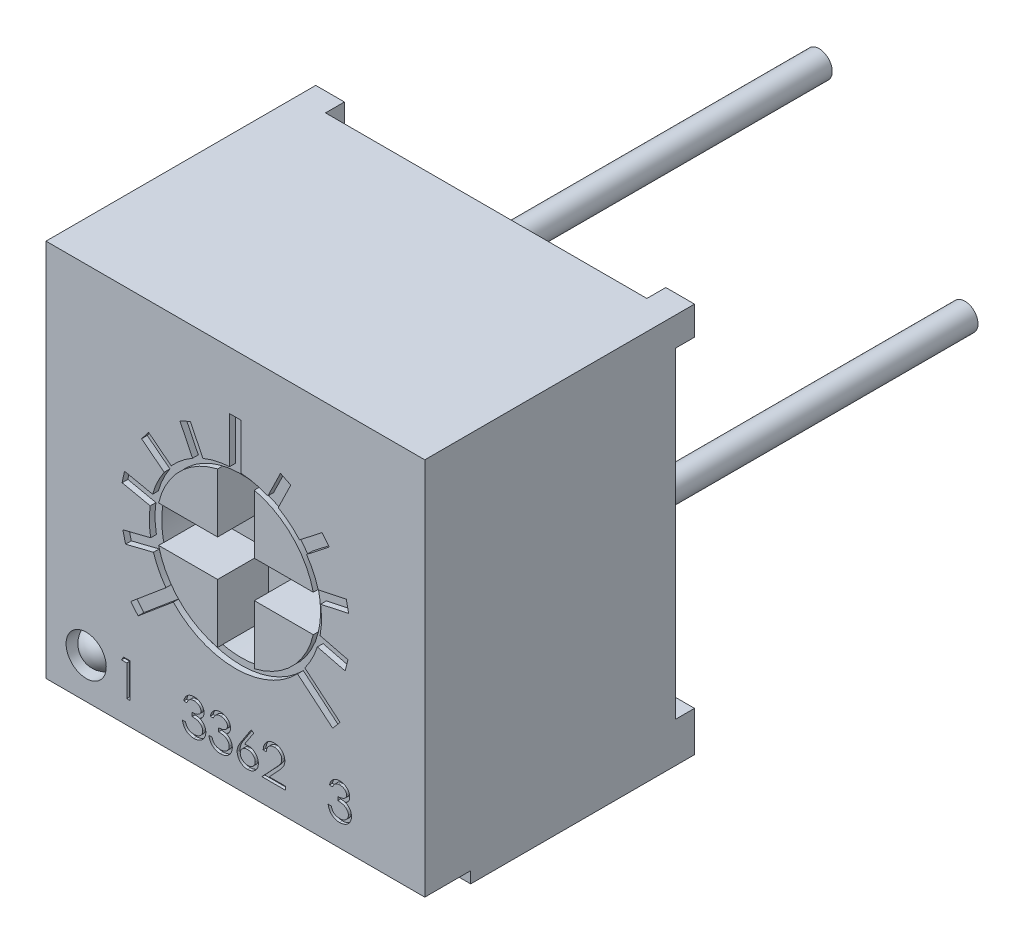
from build123d import *

# Parameters (mm, degrees)
SKETCH_1_W          = 6.6
SKETCH_1_H          = 6.6
EXTRUDE_1_DEPTH     = 4.7
SKETCH_2_R          = 1.385
CUT_EXTRUDE_1_DEPTH = 0.9
EXTRUDE_2_DEPTH     = 0.89
EXTRUDE_2_2_DEPTH   = 0.89
EXTRUDE_2_3_DEPTH   = 0.89
EXTRUDE_2_4_DEPTH   = 0.89
SKETCH_4_R          = 1.385
CUT_EXTRUDE_2_DEPTH = 0.1
SKETCH_6_R          = 0.35
CUT_EXTRUDE_3_DEPTH = 0.35
DOME_1_FACE_RADIUS  = 0.35
DOME_1_HEIGHT       = 0.35
SKETCH_13_W         = 0.53
SKETCH_13_H         = 3.9
SKETCH_13_W_2       = 2.08
EXTRUDE_4_DEPTH     = 0.2
SKETCH_14_W         = 1.04
SKETCH_14_H         = 3.9
EXTRUDE_5_DEPTH     = 0.254
SKETCH_8_W          = 5.6
SKETCH_8_H          = 0.33
CUT_EXTRUDE_4_DEPTH = 10.096093447
SKETCH_9_W          = 0.33
SKETCH_9_H          = 5.6
CUT_EXTRUDE_5_DEPTH = 9.929866516
SKETCH_10_R         = 0.23
EXTRUDE_3_DEPTH     = 5.8
EXTRUDE_3_2_DEPTH   = 5.8
EXTRUDE_3_3_DEPTH   = 5.8
CUT_EXTRUDE_6_DEPTH = 0.05


with BuildPart() as part:
    # Эскиз1 → Бобышка-Вытянуть1 (new body)
    with BuildSketch(Plane.XY):
        Rectangle(SKETCH_1_W, SKETCH_1_H)
    extrude(amount=EXTRUDE_1_DEPTH)

    # Эскиз2 → Вырез-Вытянуть1 (cut)
    with BuildSketch(Plane.XY.offset(4.7)):
        Circle(SKETCH_2_R)
    extrude(amount=-CUT_EXTRUDE_1_DEPTH, mode=Mode.SUBTRACT)

    # Эскиз4 → Вырез-Вытянуть2 (cut)
    with BuildSketch(Plane.XY.offset(4.7)):
        with BuildLine():
            Line((-0.1, 2.296662955), (-0.1, 1.496662955))
            ThreePointArc((-0.1, 1.496662955), (-0.337426582, 1.461555097), (-0.566214451, 1.389028868))
            Line((-0.566214451, 1.389028868), (-0.785400025, 1.838425891))
            Line((-0.785400025, 1.838425891), (-0.965158834, 1.750751661))
            Line((-0.965158834, 1.750751661), (-0.74597326, 1.301354638))
            ThreePointArc((-0.74597326, 1.301354638), (-0.943980587, 1.165718942), (-1.117820355, 1.000238798))
            Line((-1.117820355, 1.000238798), (-1.511825732, 1.308069536))
            Line((-1.511825732, 1.308069536), (-1.634958027, 1.150467385))
            Line((-1.634958027, 1.150467385), (-1.24095265, 0.842636647))
            ThreePointArc((-1.24095265, 0.842636647), (-1.359461681, 0.633927393), (-1.443166109, 0.408988486))
            Line((-1.443166109, 0.408988486), (-1.93223991, 0.512944331))
            Line((-1.93223991, 0.512944331), (-1.973822248, 0.317314811))
            Line((-1.973822248, 0.317314811), (-1.484748447, 0.213358965))
            ThreePointArc((-1.484748447, 0.213358965), (-1.499771543, -0.02617861), (-1.476397858, -0.265045966))
            Line((-1.476397858, -0.265045966), (-1.961545721, -0.386006914))
            Line((-1.961545721, -0.386006914), (-1.913161342, -0.58006606))
            Line((-1.913161342, -0.58006606), (-1.428013479, -0.459105112))
            ThreePointArc((-1.428013479, -0.459105112), (-1.336509786, -0.68098575), (-1.210789101, -0.885431959))
            Line((-1.210789101, -0.885431959), (-1.823624655, -1.399662047))
            Line((-1.823624655, -1.399662047), (-1.695067133, -1.552870935))
            Line((-1.695067133, -1.552870935), (-1.082231579, -1.038640847))
            ThreePointArc((-1.082231579, -1.038640847), (0, -1.5), (1.082231579, -1.038640847))
            Line((1.082231579, -1.038640847), (1.695067133, -1.552870935))
            Line((1.695067133, -1.552870935), (1.823624655, -1.399662047))
            Line((1.823624655, -1.399662047), (1.210789101, -0.885431959))
            ThreePointArc((1.210789101, -0.885431959), (1.336509786, -0.68098575), (1.428013479, -0.459105112))
            Line((1.428013479, -0.459105112), (1.913161342, -0.58006606))
            Line((1.913161342, -0.58006606), (1.961545721, -0.386006914))
            Line((1.961545721, -0.386006914), (1.476397858, -0.265045966))
            ThreePointArc((1.476397858, -0.265045966), (1.499771543, -0.02617861), (1.484748447, 0.213358965))
            Line((1.484748447, 0.213358965), (1.973822248, 0.317314811))
            Line((1.973822248, 0.317314811), (1.93223991, 0.512944331))
            Line((1.93223991, 0.512944331), (1.443166109, 0.408988486))
            ThreePointArc((1.443166109, 0.408988486), (1.359461681, 0.633927393), (1.24095265, 0.842636647))
            Line((1.24095265, 0.842636647), (1.634958027, 1.150467385))
            Line((1.634958027, 1.150467385), (1.511825732, 1.308069536))
            Line((1.511825732, 1.308069536), (1.117820355, 1.000238798))
            ThreePointArc((1.117820355, 1.000238798), (0.943980587, 1.165718942), (0.74597326, 1.301354638))
            Line((0.74597326, 1.301354638), (0.965158834, 1.750751661))
            Line((0.965158834, 1.750751661), (0.785400025, 1.838425891))
            Line((0.785400025, 1.838425891), (0.566214451, 1.389028868))
            ThreePointArc((0.566214451, 1.389028868), (0.337426582, 1.461555097), (0.1, 1.496662955))
            Line((0.1, 1.496662955), (0.1, 2.296662955))
            Line((0.1, 2.296662955), (-0.1, 2.296662955))
        make_face()
        Circle(SKETCH_4_R, mode=Mode.SUBTRACT)
    extrude(amount=-CUT_EXTRUDE_2_DEPTH, mode=Mode.SUBTRACT)

    # Эскиз6 → Вырез-Вытянуть3 (cut)
    with BuildSketch(Plane.XY.offset(4.7)):
        with Locations((-2.6, -2.6)):
            Circle(SKETCH_6_R)
    extrude(amount=-CUT_EXTRUDE_3_DEPTH, mode=Mode.SUBTRACT)

    # Купол1: a dome of height H over a round flat face of radius A is a cap of a sphere of radius (A * A + H * H) / (2 * H)
    dome_1_r = (DOME_1_FACE_RADIUS * DOME_1_FACE_RADIUS + DOME_1_HEIGHT * DOME_1_HEIGHT) / (2 * DOME_1_HEIGHT)
    dome_1_base = Plane((-2.6, -2.6, 4.35), z_dir=(0, 0, 1))
    with Locations(dome_1_base.offset(DOME_1_HEIGHT - dome_1_r)):
        dome_1_ball = Sphere(dome_1_r, mode=Mode.PRIVATE)
    add(split(dome_1_ball, bisect_by=dome_1_base, keep=Keep.TOP, mode=Mode.PRIVATE))

    # Эскиз13 → Бобышка-Вытянуть4 (add)
    with BuildSketch(Plane.XZ.offset(3.3)):
        with Locations((-3.035, 1.95)):
            Rectangle(SKETCH_13_W, SKETCH_13_H)
        with Locations((-1.27, 1.95)):
            Rectangle(SKETCH_13_W_2, SKETCH_13_H)
        with Locations((1.27, 1.95)):
            Rectangle(SKETCH_13_W_2, SKETCH_13_H)
        with Locations((3.035, 1.95)):
            Rectangle(SKETCH_13_W, SKETCH_13_H)
    extrude(amount=EXTRUDE_4_DEPTH)

    # Эскиз14 → Бобышка-Вытянуть5 (add)
    with BuildSketch(Plane(origin=(0, -3.5, 0), x_dir=(-1, 0, 0), z_dir=(0, -1, 0))):
        with Locations((1.79, -1.95)):
            Rectangle(SKETCH_14_W, SKETCH_14_H)
        with Locations((-1.79, -1.95)):
            Rectangle(SKETCH_14_W, SKETCH_14_H)
    extrude(amount=EXTRUDE_5_DEPTH)

    # Эскиз8 → Вырез-Вытянуть4 (cut, through all)
    with BuildSketch(Plane(origin=(0, 3.3, 0), x_dir=(1, 0, 0), z_dir=(0, 1, 0))):
        with Locations((0, -0.165)):
            Rectangle(SKETCH_8_W, SKETCH_8_H)
    extrude(amount=-CUT_EXTRUDE_4_DEPTH, mode=Mode.SUBTRACT)

    # Эскиз9 → Вырез-Вытянуть5 (cut, through all)
    with BuildSketch(Plane(origin=(3.3, 0, 0), x_dir=(0, 0, -1), z_dir=(1, 0, 0))):
        with Locations((-0.165, 0)):
            Rectangle(SKETCH_9_W, SKETCH_9_H)
    extrude(amount=-CUT_EXTRUDE_5_DEPTH, mode=Mode.SUBTRACT)

    # Эскиз11 → Вырез-Вытянуть6 (cut)
    # profile 1 of 6: a face of its own
    with BuildSketch(Plane.XY.offset(4.7)):
        Polygon((-1.949399038, -2.3), (-1.838461538, -2.3), (-1.838461538, -2.9), (-1.892307692, -2.9), (-1.892307692, -2.361538462), (-1.984615385, -2.361538462), align=None)
    # profile 2 of 6: a face of its own
    with BuildSketch(Plane.XY.offset(4.7)):
        with BuildLine():
            Line((-0.846153846, -2.438461538), (-0.9, -2.438461538))
            add(Edge.make_bspline(
                [(-0.9, -2.438461538), (-0.89854122, -2.432421684), (-0.895689424, -2.420614263), (-0.889741269, -2.403744447), (-0.883261396, -2.387780414), (-0.875480407, -2.373021087), (-0.866993192, -2.359169847), (-0.857269297, -2.346540854), (-0.846757344, -2.334812917), (-0.83513021, -2.324404934), (-0.822936725, -2.31498018), (-0.810005076, -2.306944456), (-0.796595437, -2.300031744), (-0.7826149, -2.294336847), (-0.768021842, -2.290046757), (-0.752948193, -2.286934162), (-0.73735445, -2.284912828), (-0.726769148, -2.284715555), (-0.721394231, -2.284615385)],
                knots=[0, 0, 0, 0, 1.162005537, 2.271625781, 3.343758855, 4.383309926, 5.390229558, 6.379919256, 7.361854164, 8.333198761, 9.295911338, 10.242430842, 11.177959212, 12.116337295, 13.062827104, 14.020064771, 14.994644689, 16, 16, 16, 16], degree=3))
            add(Edge.make_bspline(
                [(-0.721394231, -2.284615385), (-0.713562904, -2.284851824), (-0.698071073, -2.285319546), (-0.675311694, -2.289590592), (-0.653364239, -2.296349186), (-0.632468939, -2.305687539), (-0.613060065, -2.317205364), (-0.595791005, -2.330913605), (-0.580895831, -2.346547771), (-0.568399652, -2.36381621), (-0.558615367, -2.382271441), (-0.55140056, -2.401265753), (-0.547008272, -2.420754091), (-0.546439033, -2.433912482), (-0.546153846, -2.440504808)],
                knots=[0, 0, 0, 0, 1.083050992, 2.142477498, 3.193116406, 4.255571735, 5.30263384, 6.308962982, 7.297363603, 8.282367274, 9.249857812, 10.179914175, 11.08814088, 12, 12, 12, 12], degree=3))
            add(Edge.make_bspline(
                [(-0.546153846, -2.440504808), (-0.546353319, -2.44684883), (-0.546743656, -2.459263096), (-0.550058006, -2.477386781), (-0.555635651, -2.494468199), (-0.563361896, -2.510579255), (-0.573363304, -2.525617799), (-0.585478624, -2.539617666), (-0.599793366, -2.55264095), (-0.610641184, -2.560101431), (-0.616225962, -2.563942308)],
                knots=[0, 0, 0, 0, 1.024540389, 2.004866551, 2.965041327, 3.920577974, 4.882998113, 5.874504559, 6.905732034, 8, 8, 8, 8], degree=3))
            add(Edge.make_bspline(
                [(-0.616225962, -2.563942308), (-0.609843375, -2.56702428), (-0.597197625, -2.573130558), (-0.579960392, -2.585105831), (-0.564312756, -2.598932634), (-0.555586404, -2.609722803), (-0.551201923, -2.615144231)],
                knots=[0, 0, 0, 0, 1.015518401, 2.012035669, 3.001164323, 4, 4, 4, 4], degree=3))
            add(Edge.make_bspline(
                [(-0.551201923, -2.615144231), (-0.548314836, -2.619096988), (-0.542587939, -2.626937774), (-0.535518991, -2.639544018), (-0.529106, -2.652289988), (-0.524108819, -2.665517315), (-0.520239013, -2.679072688), (-0.517472837, -2.692979385), (-0.515754412, -2.70724876), (-0.515508318, -2.716902328), (-0.515384615, -2.721754808)],
                knots=[0, 0, 0, 0, 1.025084078, 2.033381695, 3.024893161, 4.013698104, 4.991890475, 5.976764909, 6.982997093, 8, 8, 8, 8], degree=3))
            add(Edge.make_bspline(
                [(-0.515384615, -2.721754808), (-0.515692246, -2.730156474), (-0.51630606, -2.746920269), (-0.521792473, -2.771687364), (-0.5302976, -2.79589745), (-0.542375932, -2.819053137), (-0.557096076, -2.840718345), (-0.57460876, -2.860102855), (-0.594715002, -2.876765473), (-0.617138827, -2.890687226), (-0.641433192, -2.901816013), (-0.667417579, -2.909540146), (-0.694717589, -2.914570889), (-0.71343884, -2.915110352), (-0.722956731, -2.915384615)],
                knots=[0, 0, 0, 0, 0.955779014, 1.907060117, 2.875433937, 3.871313158, 4.872415639, 5.851225146, 6.836215519, 7.83643374, 8.849228613, 9.86973379, 10.916971861, 12, 12, 12, 12], degree=3))
            add(Edge.make_bspline(
                [(-0.722956731, -2.915384615), (-0.729371468, -2.915235779), (-0.741993532, -2.914942918), (-0.76054956, -2.912940872), (-0.778261851, -2.9092843), (-0.795154354, -2.904363733), (-0.811242074, -2.898125149), (-0.826475921, -2.890356229), (-0.840949617, -2.881217115), (-0.85452658, -2.870599928), (-0.867205192, -2.858723127), (-0.878648516, -2.845375868), (-0.889047337, -2.830804885), (-0.898123218, -2.814840932), (-0.906289553, -2.797690317), (-0.913006288, -2.779133431), (-0.9189181, -2.75933617), (-0.921666694, -2.745539986), (-0.923076923, -2.738461538)],
                knots=[0, 0, 0, 0, 1.048658725, 2.063410685, 3.046034179, 4.001477787, 4.936774919, 5.862367409, 6.792675028, 7.730719943, 8.675894397, 9.627829632, 10.600096036, 11.597688215, 12.626045268, 13.701542398, 14.82072376, 16, 16, 16, 16], degree=3))
            Line((-0.923076923, -2.738461538), (-0.869230769, -2.738461538))
            add(Edge.make_bspline(
                [(-0.869230769, -2.738461538), (-0.867827919, -2.743081369), (-0.865099254, -2.752067342), (-0.860454517, -2.764999965), (-0.855162814, -2.776855632), (-0.849486032, -2.78772131), (-0.843524013, -2.797704007), (-0.836852883, -2.806539756), (-0.829966744, -2.814616648), (-0.824775997, -2.819167153), (-0.822235577, -2.821394231)],
                knots=[0, 0, 0, 0, 1.198163088, 2.33053128, 3.407730985, 4.417276592, 5.372219308, 6.28897303, 7.162600585, 8, 8, 8, 8], degree=3))
            add(Edge.make_bspline(
                [(-0.822235577, -2.821394231), (-0.818876164, -2.823984231), (-0.812167707, -2.829156236), (-0.801236011, -2.835756515), (-0.789739173, -2.841475548), (-0.777428086, -2.845844182), (-0.764568411, -2.84954321), (-0.750952291, -2.85196387), (-0.736699854, -2.853624699), (-0.726968237, -2.853771259), (-0.721995192, -2.853846154)],
                knots=[0, 0, 0, 0, 0.946170439, 1.889420265, 2.845303464, 3.807233317, 4.801018734, 5.828864929, 6.890507805, 8, 8, 8, 8], degree=3))
            add(Edge.make_bspline(
                [(-0.721995192, -2.853846154), (-0.716380306, -2.85374057), (-0.705400881, -2.85353411), (-0.689380048, -2.851635418), (-0.674138771, -2.848870204), (-0.65984627, -2.844599407), (-0.646315326, -2.839322689), (-0.633735614, -2.832697248), (-0.621941996, -2.824923868), (-0.611085526, -2.816088583), (-0.601323439, -2.806416327), (-0.592728094, -2.7962998), (-0.585421009, -2.785781658), (-0.579526682, -2.774803695), (-0.574872302, -2.76341137), (-0.571703753, -2.751572713), (-0.569500636, -2.739384611), (-0.569321217, -2.731099644), (-0.569230769, -2.726923077)],
                knots=[0, 0, 0, 0, 1.217147791, 2.380027433, 3.494444702, 4.572153297, 5.609568379, 6.639424714, 7.649109417, 8.668170816, 9.669597737, 10.625200337, 11.543417969, 12.441394052, 13.322311151, 14.205496177, 15.095365482, 16, 16, 16, 16], degree=3))
            add(Edge.make_bspline(
                [(-0.569230769, -2.726923077), (-0.569493107, -2.721332562), (-0.570016476, -2.710179349), (-0.574012233, -2.693770622), (-0.580584609, -2.677960894), (-0.589785611, -2.663019901), (-0.600986022, -2.649172604), (-0.614077149, -2.636817493), (-0.629167702, -2.62662262), (-0.643056823, -2.61957885), (-0.655359421, -2.614772495), (-0.665887772, -2.611571072), (-0.677674619, -2.60886016), (-0.690577421, -2.606338056), (-0.704693401, -2.604191539), (-0.720007191, -2.602401514), (-0.736521893, -2.600969221), (-0.747954664, -2.600329605), (-0.753846154, -2.6)],
                knots=[0, 0, 0, 0, 1.07054697, 2.135767047, 3.216561865, 4.33974944, 5.486079747, 6.621378074, 7.775625952, 8.963672916, 9.598146892, 10.304877434, 11.070270905, 11.915000392, 12.823868403, 13.805723172, 14.86925407, 16, 16, 16, 16], degree=3))
            Line((-0.753846154, -2.6), (-0.753846154, -2.538461538))
            add(Edge.make_bspline(
                [(-0.753846154, -2.538461538), (-0.746423097, -2.538335572), (-0.731883152, -2.538088835), (-0.710644128, -2.535104605), (-0.690334417, -2.530976497), (-0.671404119, -2.524653321), (-0.654150054, -2.51730927), (-0.639180979, -2.508763177), (-0.626706611, -2.499263506), (-0.61678757, -2.48866363), (-0.609325417, -2.477295336), (-0.603869394, -2.465446766), (-0.600646481, -2.45301407), (-0.600216252, -2.44452927), (-0.6, -2.440264423)],
                knots=[0, 0, 0, 0, 1.321986639, 2.589447074, 3.816329219, 5.01088745, 6.139805852, 7.153945165, 8.075214402, 8.924034688, 9.728124013, 10.488707548, 11.240355623, 12, 12, 12, 12], degree=3))
            add(Edge.make_bspline(
                [(-0.6, -2.440264423), (-0.600071042, -2.437131095), (-0.600212376, -2.430897488), (-0.601994767, -2.421790334), (-0.604673174, -2.4129616), (-0.608355413, -2.404448833), (-0.613284019, -2.396311071), (-0.619182188, -2.388478937), (-0.626205291, -2.380997147), (-0.634253082, -2.374023378), (-0.642895105, -2.367377223), (-0.652366495, -2.361734885), (-0.662381674, -2.356910017), (-0.672951729, -2.352931245), (-0.684110963, -2.349938224), (-0.695806944, -2.347789223), (-0.708061975, -2.346445625), (-0.716422844, -2.346252182), (-0.720673077, -2.346153846)],
                knots=[0, 0, 0, 0, 0.884392785, 1.759457502, 2.611959086, 3.489218968, 4.37281399, 5.2945488, 6.255912374, 7.266815255, 8.301784654, 9.332968512, 10.37626691, 11.440494194, 12.520033166, 13.637162961, 14.798855837, 16, 16, 16, 16], degree=3))
            add(Edge.make_bspline(
                [(-0.720673077, -2.346153846), (-0.727504791, -2.346392365), (-0.740848719, -2.346858249), (-0.760085562, -2.350938765), (-0.777968876, -2.357449294), (-0.791638362, -2.365220669), (-0.801732517, -2.372892172), (-0.808945707, -2.379592009), (-0.816029223, -2.387037636), (-0.822517053, -2.395687643), (-0.829078306, -2.404956236), (-0.83505166, -2.415314582), (-0.840856178, -2.426492478), (-0.844353758, -2.434394586), (-0.846153846, -2.438461538)],
                knots=[0, 0, 0, 0, 1.472543308, 2.876219568, 4.221790263, 5.565193594, 6.249813518, 6.953379497, 7.687249741, 8.463570142, 9.283606569, 10.136032583, 11.040678096, 12, 12, 12, 12], degree=3))
        make_face()
    # profile 3 of 6: a face of its own
    with BuildSketch(Plane.XY.offset(4.7)):
        with BuildLine():
            Line((-0.384615385, -2.438461538), (-0.438461538, -2.438461538))
            add(Edge.make_bspline(
                [(-0.438461538, -2.438461538), (-0.437002758, -2.432421684), (-0.434150963, -2.420614263), (-0.428202807, -2.403744447), (-0.421722935, -2.387780414), (-0.413941945, -2.373021087), (-0.40545473, -2.359169847), (-0.395730835, -2.346540854), (-0.385218883, -2.334812917), (-0.373591749, -2.324404934), (-0.361398264, -2.31498018), (-0.348466615, -2.306944456), (-0.335056976, -2.300031744), (-0.321076439, -2.294336847), (-0.306483381, -2.290046757), (-0.291409731, -2.286934162), (-0.275815988, -2.284912828), (-0.265230687, -2.284715555), (-0.259855769, -2.284615385)],
                knots=[0, 0, 0, 0, 1.162005537, 2.271625781, 3.343758855, 4.383309926, 5.390229558, 6.379919256, 7.361854164, 8.333198761, 9.295911338, 10.242430842, 11.177959212, 12.116337295, 13.062827104, 14.020064771, 14.994644689, 16, 16, 16, 16], degree=3))
            add(Edge.make_bspline(
                [(-0.259855769, -2.284615385), (-0.252024442, -2.284851824), (-0.236532612, -2.285319546), (-0.213773232, -2.289590592), (-0.191825777, -2.296349186), (-0.170930478, -2.305687539), (-0.151521604, -2.317205364), (-0.134252543, -2.330913605), (-0.11935737, -2.346547771), (-0.106861191, -2.36381621), (-0.097076905, -2.382271441), (-0.089862098, -2.401265753), (-0.08546981, -2.420754091), (-0.084900572, -2.433912482), (-0.084615385, -2.440504808)],
                knots=[0, 0, 0, 0, 1.083050992, 2.142477498, 3.193116406, 4.255571735, 5.30263384, 6.308962982, 7.297363603, 8.282367274, 9.249857812, 10.179914175, 11.08814088, 12, 12, 12, 12], degree=3))
            add(Edge.make_bspline(
                [(-0.084615385, -2.440504808), (-0.084814857, -2.44684883), (-0.085205195, -2.459263096), (-0.088519544, -2.477386781), (-0.094097189, -2.494468199), (-0.101823434, -2.510579255), (-0.111824843, -2.525617799), (-0.123940162, -2.539617666), (-0.138254904, -2.55264095), (-0.149102722, -2.560101431), (-0.1546875, -2.563942308)],
                knots=[0, 0, 0, 0, 1.024540389, 2.004866551, 2.965041327, 3.920577974, 4.882998113, 5.874504559, 6.905732034, 8, 8, 8, 8], degree=3))
            add(Edge.make_bspline(
                [(-0.1546875, -2.563942308), (-0.148304914, -2.56702428), (-0.135659164, -2.573130558), (-0.11842193, -2.585105831), (-0.102774294, -2.598932634), (-0.094047942, -2.609722803), (-0.089663462, -2.615144231)],
                knots=[0, 0, 0, 0, 1.015518401, 2.012035669, 3.001164323, 4, 4, 4, 4], degree=3))
            add(Edge.make_bspline(
                [(-0.089663462, -2.615144231), (-0.086776374, -2.619096988), (-0.081049478, -2.626937774), (-0.073980529, -2.639544018), (-0.067567538, -2.652289988), (-0.062570358, -2.665517315), (-0.058700552, -2.679072688), (-0.055934375, -2.692979385), (-0.054215951, -2.70724876), (-0.053969856, -2.716902328), (-0.053846154, -2.721754808)],
                knots=[0, 0, 0, 0, 1.025084078, 2.033381695, 3.024893161, 4.013698104, 4.991890475, 5.976764909, 6.982997093, 8, 8, 8, 8], degree=3))
            add(Edge.make_bspline(
                [(-0.053846154, -2.721754808), (-0.054153785, -2.730156474), (-0.054767599, -2.746920269), (-0.060254012, -2.771687364), (-0.068759139, -2.79589745), (-0.08083747, -2.819053137), (-0.095557615, -2.840718345), (-0.113070299, -2.860102855), (-0.13317654, -2.876765473), (-0.155600366, -2.890687226), (-0.179894731, -2.901816013), (-0.205879118, -2.909540146), (-0.233179127, -2.914570889), (-0.251900378, -2.915110352), (-0.261418269, -2.915384615)],
                knots=[0, 0, 0, 0, 0.955779014, 1.907060117, 2.875433937, 3.871313158, 4.872415639, 5.851225146, 6.836215519, 7.83643374, 8.849228613, 9.86973379, 10.916971861, 12, 12, 12, 12], degree=3))
            add(Edge.make_bspline(
                [(-0.261418269, -2.915384615), (-0.267833006, -2.915235779), (-0.28045507, -2.914942918), (-0.299011098, -2.912940872), (-0.31672339, -2.9092843), (-0.333615892, -2.904363733), (-0.349703613, -2.898125149), (-0.364937459, -2.890356229), (-0.379411155, -2.881217115), (-0.392988118, -2.870599928), (-0.40566673, -2.858723127), (-0.417110054, -2.845375868), (-0.427508876, -2.830804885), (-0.436584757, -2.814840932), (-0.444751092, -2.797690317), (-0.451467827, -2.779133431), (-0.457379639, -2.75933617), (-0.460128233, -2.745539986), (-0.461538462, -2.738461538)],
                knots=[0, 0, 0, 0, 1.048658725, 2.063410685, 3.046034179, 4.001477787, 4.936774919, 5.862367409, 6.792675028, 7.730719943, 8.675894397, 9.627829632, 10.600096036, 11.597688215, 12.626045268, 13.701542398, 14.82072376, 16, 16, 16, 16], degree=3))
            Line((-0.461538462, -2.738461538), (-0.407692308, -2.738461538))
            add(Edge.make_bspline(
                [(-0.407692308, -2.738461538), (-0.406289458, -2.743081369), (-0.403560793, -2.752067342), (-0.398916056, -2.764999965), (-0.393624352, -2.776855632), (-0.387947571, -2.78772131), (-0.381985551, -2.797704007), (-0.375314421, -2.806539756), (-0.368428282, -2.814616648), (-0.363237536, -2.819167153), (-0.360697115, -2.821394231)],
                knots=[0, 0, 0, 0, 1.198163088, 2.33053128, 3.407730985, 4.417276592, 5.372219308, 6.28897303, 7.162600585, 8, 8, 8, 8], degree=3))
            add(Edge.make_bspline(
                [(-0.360697115, -2.821394231), (-0.357337702, -2.823984231), (-0.350629246, -2.829156236), (-0.339697549, -2.835756515), (-0.328200711, -2.841475548), (-0.315889624, -2.845844182), (-0.303029949, -2.84954321), (-0.28941383, -2.85196387), (-0.275161392, -2.853624699), (-0.265429776, -2.853771259), (-0.260456731, -2.853846154)],
                knots=[0, 0, 0, 0, 0.946170439, 1.889420265, 2.845303464, 3.807233317, 4.801018734, 5.828864929, 6.890507805, 8, 8, 8, 8], degree=3))
            add(Edge.make_bspline(
                [(-0.260456731, -2.853846154), (-0.254841845, -2.85374057), (-0.243862419, -2.85353411), (-0.227841586, -2.851635418), (-0.21260031, -2.848870204), (-0.198307808, -2.844599407), (-0.184776864, -2.839322689), (-0.172197153, -2.832697248), (-0.160403534, -2.824923868), (-0.149547065, -2.816088583), (-0.139784978, -2.806416327), (-0.131189633, -2.7962998), (-0.123882548, -2.785781658), (-0.11798822, -2.774803695), (-0.11333384, -2.76341137), (-0.110165292, -2.751572713), (-0.107962175, -2.739384611), (-0.107782755, -2.731099644), (-0.107692308, -2.726923077)],
                knots=[0, 0, 0, 0, 1.217147791, 2.380027433, 3.494444702, 4.572153297, 5.609568379, 6.639424714, 7.649109417, 8.668170816, 9.669597737, 10.625200337, 11.543417969, 12.441394052, 13.322311151, 14.205496177, 15.095365482, 16, 16, 16, 16], degree=3))
            add(Edge.make_bspline(
                [(-0.107692308, -2.726923077), (-0.107954645, -2.721332562), (-0.108478015, -2.710179349), (-0.112473771, -2.693770622), (-0.119046148, -2.677960894), (-0.12824715, -2.663019901), (-0.13944756, -2.649172604), (-0.152538687, -2.636817493), (-0.167629241, -2.62662262), (-0.181518361, -2.61957885), (-0.193820959, -2.614772495), (-0.204349311, -2.611571072), (-0.216136157, -2.60886016), (-0.22903896, -2.606338056), (-0.24315494, -2.604191539), (-0.258468729, -2.602401514), (-0.274983431, -2.600969221), (-0.286416202, -2.600329605), (-0.292307692, -2.6)],
                knots=[0, 0, 0, 0, 1.07054697, 2.135767047, 3.216561865, 4.33974944, 5.486079747, 6.621378074, 7.775625952, 8.963672916, 9.598146892, 10.304877434, 11.070270905, 11.915000392, 12.823868403, 13.805723172, 14.86925407, 16, 16, 16, 16], degree=3))
            Line((-0.292307692, -2.6), (-0.292307692, -2.538461538))
            add(Edge.make_bspline(
                [(-0.292307692, -2.538461538), (-0.284884635, -2.538335572), (-0.27034469, -2.538088835), (-0.249105667, -2.535104605), (-0.228795956, -2.530976497), (-0.209865657, -2.524653321), (-0.192611592, -2.51730927), (-0.177642517, -2.508763177), (-0.165168149, -2.499263506), (-0.155249109, -2.48866363), (-0.147786955, -2.477295336), (-0.142330933, -2.465446766), (-0.13910802, -2.45301407), (-0.138677791, -2.44452927), (-0.138461538, -2.440264423)],
                knots=[0, 0, 0, 0, 1.321986639, 2.589447074, 3.816329219, 5.01088745, 6.139805852, 7.153945165, 8.075214402, 8.924034688, 9.728124013, 10.488707548, 11.240355623, 12, 12, 12, 12], degree=3))
            add(Edge.make_bspline(
                [(-0.138461538, -2.440264423), (-0.13853258, -2.437131095), (-0.138673915, -2.430897488), (-0.140456305, -2.421790334), (-0.143134712, -2.4129616), (-0.146816952, -2.404448833), (-0.151745557, -2.396311071), (-0.157643726, -2.388478937), (-0.164666829, -2.380997147), (-0.17271462, -2.374023378), (-0.181356644, -2.367377223), (-0.190828034, -2.361734885), (-0.200843212, -2.356910017), (-0.211413267, -2.352931245), (-0.222572501, -2.349938224), (-0.234268482, -2.347789223), (-0.246523514, -2.346445625), (-0.254884382, -2.346252182), (-0.259134615, -2.346153846)],
                knots=[0, 0, 0, 0, 0.884392785, 1.759457502, 2.611959086, 3.489218968, 4.37281399, 5.2945488, 6.255912374, 7.266815255, 8.301784654, 9.332968512, 10.37626691, 11.440494194, 12.520033166, 13.637162961, 14.798855837, 16, 16, 16, 16], degree=3))
            add(Edge.make_bspline(
                [(-0.259134615, -2.346153846), (-0.26596633, -2.346392365), (-0.279310257, -2.346858249), (-0.2985471, -2.350938765), (-0.316430415, -2.357449294), (-0.3300999, -2.365220669), (-0.340194056, -2.372892172), (-0.347407245, -2.379592009), (-0.354490761, -2.387037636), (-0.360978592, -2.395687643), (-0.367539845, -2.404956236), (-0.373513198, -2.415314582), (-0.379317717, -2.426492478), (-0.382815297, -2.434394586), (-0.384615385, -2.438461538)],
                knots=[0, 0, 0, 0, 1.472543308, 2.876219568, 4.221790263, 5.565193594, 6.249813518, 6.953379497, 7.687249741, 8.463570142, 9.283606569, 10.136032583, 11.040678096, 12, 12, 12, 12], degree=3))
        make_face()
    # profile 4 of 6: a face of its own
    with BuildSketch(Plane.XY.offset(4.7)):
        with BuildLine():
            Line((0.276923077, -2.284615385), (0.318389423, -2.3171875))
            Line((0.318389423, -2.3171875), (0.159855769, -2.559615385))
            add(Edge.make_bspline(
                [(0.159855769, -2.559615385), (0.170410674, -2.557933009), (0.190999209, -2.554651344), (0.211839077, -2.554109982), (0.221995192, -2.553846154)],
                knots=[0, 0, 0, 0, 1.025318673, 2, 2, 2, 2], degree=3))
            add(Edge.make_bspline(
                [(0.221995192, -2.553846154), (0.228093335, -2.554010059), (0.240097346, -2.554332701), (0.257721369, -2.556815646), (0.274656615, -2.560728523), (0.290832892, -2.566432338), (0.30630826, -2.573718456), (0.321171528, -2.582450834), (0.335143301, -2.593080379), (0.348403503, -2.604954371), (0.360442434, -2.618105854), (0.371101187, -2.632060369), (0.380054351, -2.646803377), (0.387318452, -2.662327412), (0.392959288, -2.678608542), (0.397071456, -2.695625937), (0.399502243, -2.713391332), (0.399832327, -2.725473305), (0.4, -2.731610577)],
                knots=[0, 0, 0, 0, 1.04369286, 2.054478336, 3.041073146, 4.015093852, 4.984733326, 5.965804835, 6.960378782, 7.985147595, 9.009457201, 10.008161701, 10.986880575, 11.956520048, 12.937015923, 13.931873656, 14.949455224, 16, 16, 16, 16], degree=3))
            add(Edge.make_bspline(
                [(0.4, -2.731610577), (0.399756039, -2.740007098), (0.399275982, -2.756529463), (0.394492474, -2.780594041), (0.387059392, -2.803519616), (0.376434673, -2.824940159), (0.363237693, -2.844826314), (0.347144391, -2.862446679), (0.328725508, -2.878161543), (0.307899199, -2.891302678), (0.28548612, -2.902034629), (0.261940063, -2.909742957), (0.237489695, -2.914488694), (0.22089462, -2.915083655), (0.2125, -2.915384615)],
                knots=[0, 0, 0, 0, 1.031375318, 2.029502543, 3.004789286, 3.987476834, 4.960371455, 5.9300674, 6.912260825, 7.929083631, 8.949397511, 9.960523116, 10.96833055, 12, 12, 12, 12], degree=3))
            add(Edge.make_bspline(
                [(0.2125, -2.915384615), (0.20442628, -2.915122637), (0.188433654, -2.914603704), (0.164908032, -2.909980972), (0.142302943, -2.902488326), (0.120776764, -2.892165878), (0.100836087, -2.879127384), (0.082996264, -2.863430993), (0.067346245, -2.845412228), (0.054322025, -2.825073883), (0.043991956, -2.803218461), (0.036245112, -2.780429235), (0.031720042, -2.756789238), (0.031087718, -2.7407639), (0.030769231, -2.732692308)],
                knots=[0, 0, 0, 0, 1.012016664, 2.004627821, 2.994792927, 3.992885782, 4.990978636, 5.973936114, 6.964471063, 7.975201453, 8.993600317, 9.990122807, 10.98767138, 12, 12, 12, 12], degree=3))
            add(Edge.make_bspline(
                [(0.030769231, -2.732692308), (0.030971764, -2.726513236), (0.031385299, -2.713896753), (0.034272737, -2.694788634), (0.038912416, -2.67523702), (0.044108458, -2.658650587), (0.049598563, -2.645062897), (0.05416757, -2.634108013), (0.059854541, -2.622834686), (0.065918549, -2.610856349), (0.072905441, -2.598481703), (0.080502409, -2.585503931), (0.088919492, -2.572129429), (0.094820091, -2.563053282), (0.097836538, -2.558413462)],
                knots=[0, 0, 0, 0, 1.173818275, 2.396712641, 3.66331629, 4.989737886, 5.693666774, 6.447286557, 7.243889047, 8.091586357, 8.998013824, 9.943181721, 10.948533338, 12, 12, 12, 12], degree=3))
            Line((0.097836538, -2.558413462), (0.276923077, -2.284615385))
        make_face()
        with BuildLine():
            add(Edge.make_bspline(
                [(0.210697115, -2.615384615), (0.206126445, -2.615517994), (0.197198598, -2.615778522), (0.184100184, -2.617291422), (0.171703626, -2.620140405), (0.159844689, -2.623768919), (0.148745083, -2.628758015), (0.138324139, -2.634818323), (0.128541558, -2.641953383), (0.119499807, -2.65006211), (0.11130215, -2.658940059), (0.104242528, -2.66844912), (0.098152973, -2.678360126), (0.093201804, -2.688755887), (0.089346363, -2.69963243), (0.08655752, -2.71093973), (0.085005448, -2.722753611), (0.084747237, -2.730764897), (0.084615385, -2.734855769)],
                knots=[0, 0, 0, 0, 1.129588631, 2.206414736, 3.251139165, 4.268635594, 5.265702196, 6.250456724, 7.242448911, 8.251968645, 9.246821453, 10.222880186, 11.173611482, 12.116736599, 13.062300278, 14.020270554, 14.989073742, 16, 16, 16, 16], degree=3))
            add(Edge.make_bspline(
                [(0.084615385, -2.734855769), (0.084722761, -2.738910051), (0.08493331, -2.746859895), (0.086845136, -2.758575183), (0.089765436, -2.769849168), (0.094109504, -2.780623727), (0.099291256, -2.791063096), (0.106132169, -2.800789145), (0.113712189, -2.810392586), (0.122772863, -2.819135695), (0.132496868, -2.827271116), (0.142885646, -2.834382017), (0.153713068, -2.840465361), (0.165125312, -2.845232978), (0.176960463, -2.849145713), (0.189317129, -2.851899109), (0.202203905, -2.853455771), (0.21093338, -2.853714318), (0.215384615, -2.853846154)],
                knots=[0, 0, 0, 0, 0.989467248, 1.94019797, 2.891935182, 3.827694429, 4.772920941, 5.730924762, 6.725747692, 7.756678648, 8.79901574, 9.819492441, 10.826891316, 11.826466727, 12.835195252, 13.867842842, 14.912794438, 16, 16, 16, 16], degree=3))
            add(Edge.make_bspline(
                [(0.215384615, -2.853846154), (0.219835844, -2.853714308), (0.228565304, -2.85345574), (0.241452183, -2.851899225), (0.253808467, -2.849145286), (0.265645011, -2.845234525), (0.277052113, -2.840459621), (0.287870066, -2.834419863), (0.298160596, -2.827227386), (0.307890984, -2.819149598), (0.316913945, -2.810342823), (0.324675765, -2.800874871), (0.331307176, -2.790984489), (0.336695894, -2.780664851), (0.340992115, -2.769842653), (0.343927224, -2.758576929), (0.345835102, -2.746859439), (0.346046193, -2.738909897), (0.346153846, -2.734855769)],
                knots=[0, 0, 0, 0, 1.087397944, 2.132534446, 3.165364764, 4.174271784, 5.174024072, 6.181601208, 7.194203697, 8.236725232, 9.267838612, 10.269026844, 11.221737037, 12.171628256, 13.107553087, 14.05945871, 15.010357665, 16, 16, 16, 16], degree=3))
            add(Edge.make_bspline(
                [(0.346153846, -2.734855769), (0.34605951, -2.730759561), (0.345874359, -2.722720035), (0.343780197, -2.710945015), (0.34087579, -2.699574979), (0.336490127, -2.688681388), (0.330792434, -2.678307229), (0.323852421, -2.668400098), (0.315823981, -2.658884038), (0.306550117, -2.650044699), (0.296454648, -2.641962343), (0.285720548, -2.634827562), (0.27449061, -2.628806137), (0.262776219, -2.623782063), (0.250443154, -2.620156439), (0.237690524, -2.617301597), (0.224355225, -2.615782394), (0.215307807, -2.615518897), (0.210697115, -2.615384615)],
                knots=[0, 0, 0, 0, 0.978206639, 1.919901502, 2.851605144, 3.780102724, 4.718870031, 5.675451981, 6.667674623, 7.690630536, 8.733308323, 9.756129687, 10.767539656, 11.776269907, 12.797430371, 13.836405707, 14.897401972, 16, 16, 16, 16], degree=3))
        make_face(mode=Mode.SUBTRACT)
    # profile 5 of 6: a face of its own
    with BuildSketch(Plane.XY.offset(4.7)):
        with BuildLine():
            Line((0.538461538, -2.484615385), (0.484615385, -2.484615385))
            add(Edge.make_bspline(
                [(0.484615385, -2.484615385), (0.484966325, -2.477471804), (0.485655563, -2.463442001), (0.48888327, -2.442986475), (0.493501706, -2.423434223), (0.500031669, -2.404942238), (0.508141317, -2.387347014), (0.517866465, -2.37071844), (0.52938541, -2.35511995), (0.542449422, -2.340696149), (0.556638331, -2.327463994), (0.571947921, -2.316037381), (0.58803564, -2.306382923), (0.60485268, -2.298311853), (0.622588776, -2.292253593), (0.641082981, -2.287758455), (0.660416547, -2.285053939), (0.673589122, -2.284763233), (0.680288462, -2.284615385)],
                knots=[0, 0, 0, 0, 1.10065271, 2.161652631, 3.183658789, 4.190468796, 5.17591951, 6.163126047, 7.15150782, 8.156236427, 9.156009102, 10.134482811, 11.092018607, 12.041330605, 13.001268258, 13.972401359, 14.968799086, 16, 16, 16, 16], degree=3))
            add(Edge.make_bspline(
                [(0.680288462, -2.284615385), (0.68686756, -2.284769406), (0.699795253, -2.285072052), (0.718663027, -2.287671085), (0.736624849, -2.291741758), (0.753645609, -2.297452972), (0.769589506, -2.305130303), (0.784576314, -2.314352738), (0.798784453, -2.325018995), (0.811574187, -2.337576791), (0.823318429, -2.350982914), (0.833450244, -2.365295126), (0.842126786, -2.38007729), (0.84935896, -2.395442124), (0.85468287, -2.411534301), (0.858724848, -2.428119535), (0.861009548, -2.445369503), (0.861360192, -2.457044912), (0.861538462, -2.462980769)],
                knots=[0, 0, 0, 0, 1.111607364, 2.184268762, 3.212621178, 4.221274766, 5.211760367, 6.196651075, 7.1921475, 8.207485113, 9.220403448, 10.201281604, 11.166441695, 12.114753415, 13.065576456, 14.026450734, 14.996634279, 16, 16, 16, 16], degree=3))
            add(Edge.make_bspline(
                [(0.861538462, -2.462980769), (0.861248188, -2.471337541), (0.860672735, -2.487904435), (0.85575027, -2.51224984), (0.848062297, -2.535837283), (0.838805607, -2.55482082), (0.829467474, -2.570117991), (0.821052472, -2.582712626), (0.811201362, -2.596273563), (0.799770762, -2.610755393), (0.786997127, -2.626271548), (0.772764756, -2.642812656), (0.756972159, -2.660207816), (0.745887845, -2.672088776), (0.740144231, -2.678245192)],
                knots=[0, 0, 0, 0, 1.184426356, 2.348067706, 3.509069118, 4.696110526, 5.333549288, 6.050745305, 6.844228056, 7.710549037, 8.667450064, 9.695053472, 10.805634456, 12, 12, 12, 12], degree=3))
            Line((0.740144231, -2.678245192), (0.590024038, -2.838461538))
            Line((0.590024038, -2.838461538), (0.869230769, -2.838461538))
            Line((0.869230769, -2.838461538), (0.869230769, -2.9))
            Line((0.869230769, -2.9), (0.461538462, -2.9))
            Line((0.461538462, -2.9), (0.694230769, -2.651682692))
            add(Edge.make_bspline(
                [(0.694230769, -2.651682692), (0.699896121, -2.645768697), (0.710778103, -2.634409122), (0.726169402, -2.617824615), (0.739993228, -2.602438979), (0.752339067, -2.588281285), (0.762939097, -2.575144445), (0.772345765, -2.563453924), (0.779882724, -2.552696018), (0.788062506, -2.540226199), (0.795984902, -2.52500123), (0.802792735, -2.506395455), (0.806943852, -2.487242212), (0.807441824, -2.474299005), (0.807692308, -2.467788462)],
                knots=[0, 0, 0, 0, 1.329631726, 2.553950428, 3.673215718, 4.687767853, 5.603093632, 6.413772471, 7.123043292, 7.734684054, 8.834405432, 9.900288307, 10.943827018, 12, 12, 12, 12], degree=3))
            add(Edge.make_bspline(
                [(0.807692308, -2.467788462), (0.807583323, -2.463694508), (0.807368536, -2.45562611), (0.805472931, -2.443796552), (0.802608273, -2.432385441), (0.798503371, -2.421357677), (0.793085073, -2.410824137), (0.786489636, -2.400771998), (0.778879911, -2.391053889), (0.770076836, -2.381941895), (0.76040629, -2.373596546), (0.750190133, -2.366203845), (0.739381544, -2.360025712), (0.728026094, -2.354961113), (0.716155442, -2.35098819), (0.703746629, -2.348235291), (0.69083394, -2.346506865), (0.68201677, -2.346273007), (0.677524038, -2.346153846)],
                knots=[0, 0, 0, 0, 0.991446411, 1.95395049, 2.89581595, 3.838931463, 4.798493298, 5.75982156, 6.748411868, 7.785213223, 8.824556874, 9.840280684, 10.836137867, 11.835679398, 12.848801643, 13.863922112, 14.911575587, 16, 16, 16, 16], degree=3))
            add(Edge.make_bspline(
                [(0.677524038, -2.346153846), (0.672831896, -2.346276423), (0.663617302, -2.346517144), (0.650088325, -2.348201029), (0.637182192, -2.35110603), (0.624866437, -2.355079175), (0.613120222, -2.360129212), (0.602000672, -2.366419225), (0.591532748, -2.373924967), (0.581696772, -2.382434776), (0.572634376, -2.391909222), (0.564672055, -2.40247093), (0.557714795, -2.413927059), (0.551644641, -2.426246696), (0.546715094, -2.43954163), (0.542948268, -2.453764665), (0.539967666, -2.468854044), (0.538971919, -2.479274345), (0.538461538, -2.484615385)],
                knots=[0, 0, 0, 0, 1.031018746, 2.02475058, 2.990194455, 3.934040569, 4.864654155, 5.795059489, 6.735614925, 7.690564532, 8.649604399, 9.611025574, 10.590972636, 11.591080095, 12.624614302, 13.701020113, 14.821632451, 16, 16, 16, 16], degree=3))
        make_face()
    # profile 6 of 6: a face of its own
    with BuildSketch(Plane.XY.offset(4.7)):
        with BuildLine():
            Line((1.692307692, -2.438461538), (1.638461538, -2.438461538))
            add(Edge.make_bspline(
                [(1.638461538, -2.438461538), (1.639920319, -2.432421684), (1.642772114, -2.420614263), (1.64872027, -2.403744447), (1.655200142, -2.387780414), (1.662981132, -2.373021087), (1.671468347, -2.359169847), (1.681192242, -2.346540854), (1.691704194, -2.334812917), (1.703331328, -2.324404934), (1.715524813, -2.31498018), (1.728456462, -2.306944456), (1.741866101, -2.300031744), (1.755846638, -2.294336847), (1.770439696, -2.290046757), (1.785513346, -2.286934162), (1.801107089, -2.284912828), (1.81169239, -2.284715555), (1.817067308, -2.284615385)],
                knots=[0, 0, 0, 0, 1.162005537, 2.271625781, 3.343758855, 4.383309926, 5.390229558, 6.379919256, 7.361854164, 8.333198761, 9.295911338, 10.242430842, 11.177959212, 12.116337295, 13.062827104, 14.020064771, 14.994644689, 16, 16, 16, 16], degree=3))
            add(Edge.make_bspline(
                [(1.817067308, -2.284615385), (1.824898635, -2.284851824), (1.840390465, -2.285319546), (1.863149845, -2.289590592), (1.8850973, -2.296349186), (1.905992599, -2.305687539), (1.925401473, -2.317205364), (1.942670534, -2.330913605), (1.957565707, -2.346547771), (1.970061886, -2.36381621), (1.979846172, -2.382271441), (1.987060979, -2.401265753), (1.991453267, -2.420754091), (1.992022505, -2.433912482), (1.992307692, -2.440504808)],
                knots=[0, 0, 0, 0, 1.083050992, 2.142477498, 3.193116406, 4.255571735, 5.30263384, 6.308962982, 7.297363603, 8.282367274, 9.249857812, 10.179914175, 11.08814088, 12, 12, 12, 12], degree=3))
            add(Edge.make_bspline(
                [(1.992307692, -2.440504808), (1.99210822, -2.44684883), (1.991717882, -2.459263096), (1.988403533, -2.477386781), (1.982825888, -2.494468199), (1.975099643, -2.510579255), (1.965098234, -2.525617799), (1.952982915, -2.539617666), (1.938668173, -2.55264095), (1.927820355, -2.560101431), (1.922235577, -2.563942308)],
                knots=[0, 0, 0, 0, 1.024540389, 2.004866551, 2.965041327, 3.920577974, 4.882998113, 5.874504559, 6.905732034, 8, 8, 8, 8], degree=3))
            add(Edge.make_bspline(
                [(1.922235577, -2.563942308), (1.928618163, -2.56702428), (1.941263913, -2.573130558), (1.958501147, -2.585105831), (1.974148783, -2.598932634), (1.982875135, -2.609722803), (1.987259615, -2.615144231)],
                knots=[0, 0, 0, 0, 1.015518401, 2.012035669, 3.001164323, 4, 4, 4, 4], degree=3))
            add(Edge.make_bspline(
                [(1.987259615, -2.615144231), (1.990146703, -2.619096988), (1.995873599, -2.626937774), (2.002942548, -2.639544018), (2.009355539, -2.652289988), (2.014352719, -2.665517315), (2.018222525, -2.679072688), (2.020988702, -2.692979385), (2.022707126, -2.70724876), (2.022953221, -2.716902328), (2.023076923, -2.721754808)],
                knots=[0, 0, 0, 0, 1.025084078, 2.033381695, 3.024893161, 4.013698104, 4.991890475, 5.976764909, 6.982997093, 8, 8, 8, 8], degree=3))
            add(Edge.make_bspline(
                [(2.023076923, -2.721754808), (2.022769292, -2.730156474), (2.022155478, -2.746920269), (2.016669065, -2.771687364), (2.008163938, -2.79589745), (1.996085607, -2.819053137), (1.981365462, -2.840718345), (1.963852778, -2.860102855), (1.943746537, -2.876765473), (1.921322711, -2.890687226), (1.897028346, -2.901816013), (1.871043959, -2.909540146), (1.84374395, -2.914570889), (1.825022699, -2.915110352), (1.815504808, -2.915384615)],
                knots=[0, 0, 0, 0, 0.955779014, 1.907060117, 2.875433937, 3.871313158, 4.872415639, 5.851225146, 6.836215519, 7.83643374, 8.849228613, 9.86973379, 10.916971861, 12, 12, 12, 12], degree=3))
            add(Edge.make_bspline(
                [(1.815504808, -2.915384615), (1.809090071, -2.915235779), (1.796468007, -2.914942918), (1.777911978, -2.912940872), (1.760199687, -2.9092843), (1.743307185, -2.904363733), (1.727219464, -2.898125149), (1.711985618, -2.890356229), (1.697511922, -2.881217115), (1.683934958, -2.870599928), (1.671256347, -2.858723127), (1.659813023, -2.845375868), (1.649414201, -2.830804885), (1.64033832, -2.814840932), (1.632171985, -2.797690317), (1.62545525, -2.779133431), (1.619543438, -2.75933617), (1.616794844, -2.745539986), (1.615384615, -2.738461538)],
                knots=[0, 0, 0, 0, 1.048658725, 2.063410685, 3.046034179, 4.001477787, 4.936774919, 5.862367409, 6.792675028, 7.730719943, 8.675894397, 9.627829632, 10.600096036, 11.597688215, 12.626045268, 13.701542398, 14.82072376, 16, 16, 16, 16], degree=3))
            Line((1.615384615, -2.738461538), (1.669230769, -2.738461538))
            add(Edge.make_bspline(
                [(1.669230769, -2.738461538), (1.670633619, -2.743081369), (1.673362284, -2.752067342), (1.678007021, -2.764999965), (1.683298725, -2.776855632), (1.688975506, -2.78772131), (1.694937526, -2.797704007), (1.701608656, -2.806539756), (1.708494795, -2.814616648), (1.713685541, -2.819167153), (1.716225962, -2.821394231)],
                knots=[0, 0, 0, 0, 1.198163088, 2.33053128, 3.407730985, 4.417276592, 5.372219308, 6.28897303, 7.162600585, 8, 8, 8, 8], degree=3))
            add(Edge.make_bspline(
                [(1.716225962, -2.821394231), (1.719585375, -2.823984231), (1.726293831, -2.829156236), (1.737225528, -2.835756515), (1.748722366, -2.841475548), (1.761033453, -2.845844182), (1.773893127, -2.84954321), (1.787509247, -2.85196387), (1.801761684, -2.853624699), (1.811493301, -2.853771259), (1.816466346, -2.853846154)],
                knots=[0, 0, 0, 0, 0.946170439, 1.889420265, 2.845303464, 3.807233317, 4.801018734, 5.828864929, 6.890507805, 8, 8, 8, 8], degree=3))
            add(Edge.make_bspline(
                [(1.816466346, -2.853846154), (1.822081232, -2.85374057), (1.833060658, -2.85353411), (1.849081491, -2.851635418), (1.864322767, -2.848870204), (1.878615269, -2.844599407), (1.892146213, -2.839322689), (1.904725924, -2.832697248), (1.916519543, -2.824923868), (1.927376012, -2.816088583), (1.937138099, -2.806416327), (1.945733444, -2.7962998), (1.953040529, -2.785781658), (1.958934857, -2.774803695), (1.963589237, -2.76341137), (1.966757785, -2.751572713), (1.968960902, -2.739384611), (1.969140321, -2.731099644), (1.969230769, -2.726923077)],
                knots=[0, 0, 0, 0, 1.217147791, 2.380027433, 3.494444702, 4.572153297, 5.609568379, 6.639424714, 7.649109417, 8.668170816, 9.669597737, 10.625200337, 11.543417969, 12.441394052, 13.322311151, 14.205496177, 15.095365482, 16, 16, 16, 16], degree=3))
            add(Edge.make_bspline(
                [(1.969230769, -2.726923077), (1.968968432, -2.721332562), (1.968445062, -2.710179349), (1.964449306, -2.693770622), (1.957876929, -2.677960894), (1.948675927, -2.663019901), (1.937475517, -2.649172604), (1.92438439, -2.636817493), (1.909293836, -2.62662262), (1.895404716, -2.61957885), (1.883102118, -2.614772495), (1.872573766, -2.611571072), (1.86078692, -2.60886016), (1.847884117, -2.606338056), (1.833768137, -2.604191539), (1.818454348, -2.602401514), (1.801939646, -2.600969221), (1.790506874, -2.600329605), (1.784615385, -2.6)],
                knots=[0, 0, 0, 0, 1.07054697, 2.135767047, 3.216561865, 4.33974944, 5.486079747, 6.621378074, 7.775625952, 8.963672916, 9.598146892, 10.304877434, 11.070270905, 11.915000392, 12.823868403, 13.805723172, 14.86925407, 16, 16, 16, 16], degree=3))
            Line((1.784615385, -2.6), (1.784615385, -2.538461538))
            add(Edge.make_bspline(
                [(1.784615385, -2.538461538), (1.792038442, -2.538335572), (1.806578387, -2.538088835), (1.82781741, -2.535104605), (1.848127121, -2.530976497), (1.86705742, -2.524653321), (1.884311485, -2.51730927), (1.899280559, -2.508763177), (1.911754928, -2.499263506), (1.921673968, -2.48866363), (1.929136122, -2.477295336), (1.934592144, -2.465446766), (1.937815057, -2.45301407), (1.938245286, -2.44452927), (1.938461538, -2.440264423)],
                knots=[0, 0, 0, 0, 1.321986639, 2.589447074, 3.816329219, 5.01088745, 6.139805852, 7.153945165, 8.075214402, 8.924034688, 9.728124013, 10.488707548, 11.240355623, 12, 12, 12, 12], degree=3))
            add(Edge.make_bspline(
                [(1.938461538, -2.440264423), (1.938390497, -2.437131095), (1.938249162, -2.430897488), (1.936466772, -2.421790334), (1.933788365, -2.4129616), (1.930106125, -2.404448833), (1.92517752, -2.396311071), (1.919279351, -2.388478937), (1.912256248, -2.380997147), (1.904208457, -2.374023378), (1.895566433, -2.367377223), (1.886095043, -2.361734885), (1.876079865, -2.356910017), (1.86550981, -2.352931245), (1.854350576, -2.349938224), (1.842654594, -2.347789223), (1.830399563, -2.346445625), (1.822038695, -2.346252182), (1.817788462, -2.346153846)],
                knots=[0, 0, 0, 0, 0.884392785, 1.759457502, 2.611959086, 3.489218968, 4.37281399, 5.2945488, 6.255912374, 7.266815255, 8.301784654, 9.332968512, 10.37626691, 11.440494194, 12.520033166, 13.637162961, 14.798855837, 16, 16, 16, 16], degree=3))
            add(Edge.make_bspline(
                [(1.817788462, -2.346153846), (1.810956747, -2.346392365), (1.79761282, -2.346858249), (1.778375977, -2.350938765), (1.760492662, -2.357449294), (1.746823177, -2.365220669), (1.736729021, -2.372892172), (1.729515832, -2.379592009), (1.722432316, -2.387037636), (1.715944485, -2.395687643), (1.709383232, -2.404956236), (1.703409879, -2.415314582), (1.69760536, -2.426492478), (1.69410778, -2.434394586), (1.692307692, -2.438461538)],
                knots=[0, 0, 0, 0, 1.472543308, 2.876219568, 4.221790263, 5.565193594, 6.249813518, 6.953379497, 7.687249741, 8.463570142, 9.283606569, 10.136032583, 11.040678096, 12, 12, 12, 12], degree=3))
        make_face()
    extrude(amount=-CUT_EXTRUDE_6_DEPTH, mode=Mode.SUBTRACT)


with BuildPart() as body_2:
    # Эскиз3 → Бобышка-Вытянуть2 (new body)
    with BuildSketch(Plane.XY.offset(3.8)):
        with BuildLine():
            Line((-0.32, 1.34752551), (-0.32, 0.32))
            Line((-0.32, 0.32), (-1.34752551, 0.32))
            ThreePointArc((-1.34752551, 0.32), (-0.979342892, 0.979342892), (-0.32, 1.34752551))
        make_face()
    extrude(amount=EXTRUDE_2_DEPTH)


with BuildPart() as body_3:
    # Эскиз3 → Extrude 2 2 (new body)
    with BuildSketch(Plane.XY.offset(3.8)):
        with BuildLine():
            Line((0.32, 1.34752551), (0.32, 0.32))
            Line((0.32, 0.32), (1.34752551, 0.32))
            ThreePointArc((1.34752551, 0.32), (0.979342892, 0.979342892), (0.32, 1.34752551))
        make_face()
    extrude(amount=EXTRUDE_2_2_DEPTH)


with BuildPart() as body_4:
    # Эскиз3 → Extrude 2 3 (new body)
    with BuildSketch(Plane.XY.offset(3.8)):
        with BuildLine():
            Line((-1.34752551, -0.32), (-0.32, -0.32))
            Line((-0.32, -0.32), (-0.32, -1.34752551))
            ThreePointArc((-0.32, -1.34752551), (-0.979342892, -0.979342892), (-1.34752551, -0.32))
        make_face()
    extrude(amount=EXTRUDE_2_3_DEPTH)


with BuildPart() as body_5:
    # Эскиз3 → Extrude 2 4 (new body)
    with BuildSketch(Plane.XY.offset(3.8)):
        with BuildLine():
            Line((0.32, -0.32), (1.34752551, -0.32))
            ThreePointArc((1.34752551, -0.32), (0.979342892, -0.979342892), (0.32, -1.34752551))
            Line((0.32, -1.34752551), (0.32, -0.32))
        make_face()
    extrude(amount=EXTRUDE_2_4_DEPTH)


with BuildPart() as body_6:
    # Эскиз10 → Бобышка-Вытянуть3 (new body)
    with BuildSketch(Plane(origin=(0, 0, 0.33), x_dir=(-1, 0, 0), z_dir=(0, 0, -1))):
        with Locations((-2.54, 0)):
            Circle(SKETCH_10_R)
    extrude(amount=EXTRUDE_3_DEPTH)


with BuildPart() as body_7:
    # Эскиз10 → Extrude 3 2 (new body)
    with BuildSketch(Plane(origin=(0, 0, 0.33), x_dir=(-1, 0, 0), z_dir=(0, 0, -1))):
        with Locations((2.54, 0)):
            Circle(SKETCH_10_R)
    extrude(amount=EXTRUDE_3_2_DEPTH)


with BuildPart() as body_8:
    # Эскиз10 → Extrude 3 3 (new body)
    with BuildSketch(Plane(origin=(0, 0, 0.33), x_dir=(-1, 0, 0), z_dir=(0, 0, -1))):
        with Locations((0, 2.54)):
            Circle(SKETCH_10_R)
    extrude(amount=EXTRUDE_3_3_DEPTH)


solid = Compound([part.part, body_2.part, body_3.part, body_4.part, body_5.part, body_6.part, body_7.part, body_8.part])
